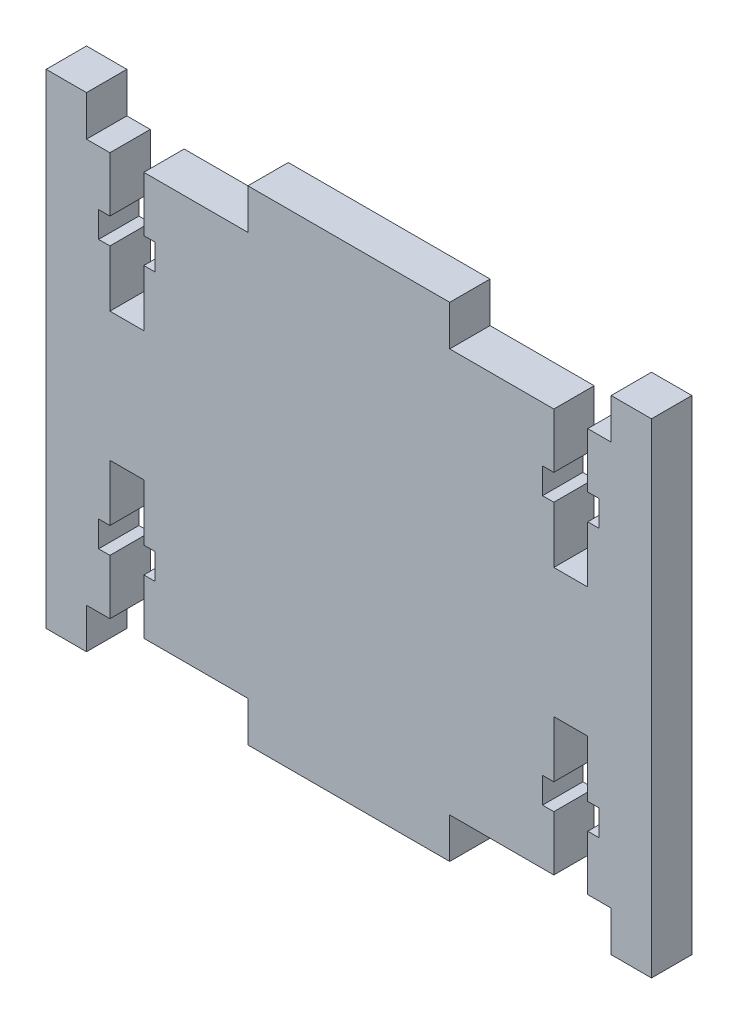
from build123d import *

# Parameters (mm, degrees)
BOSS_EXTRUDE1_DEPTH = 5


with BuildPart() as part:
    # Sketch1 → Boss-Extrude1 (new body)
    with BuildSketch(Plane.XY):
        Polygon((2.9, 50), (0, 50), (0, 55), (-5, 55), (-5, -5), (0, -5), (0, 0), (2.9, 0), (2.9, 6.8), (1.5, 6.8), (1.5, 10), (2.9, 10), (2.9, 17), (7.1, 17), (7.1, 10), (8.5, 10), (8.5, 6.8), (7.1, 6.8), (7.1, 0), (20, 0), (20, -5), (45, -5), (45, 0), (57.9, 0), (57.9, 6.8), (56.5, 6.8), (56.5, 10), (57.9, 10), (57.9, 17), (62.1, 17), (62.1, 10), (63.5, 10), (63.5, 6.8), (62.1, 6.8), (62.1, 0), (65, 0), (65, -5), (70, -5), (70, 55), (65, 55), (65, 50), (62.1, 50), (62.1, 43.2), (63.5, 43.2), (63.5, 40), (62.1, 40), (62.1, 33), (57.9, 33), (57.9, 40), (56.5, 40), (56.5, 43.2), (57.9, 43.2), (57.9, 50), (45, 50), (45, 55), (20, 55), (20, 50), (7.1, 50), (7.1, 43.2), (8.5, 43.2), (8.5, 40), (7.1, 40), (7.1, 33), (2.9, 33), (2.9, 40), (1.5, 40), (1.5, 43.2), (2.9, 43.2), align=None)
    extrude(amount=BOSS_EXTRUDE1_DEPTH)


solid = part.part
